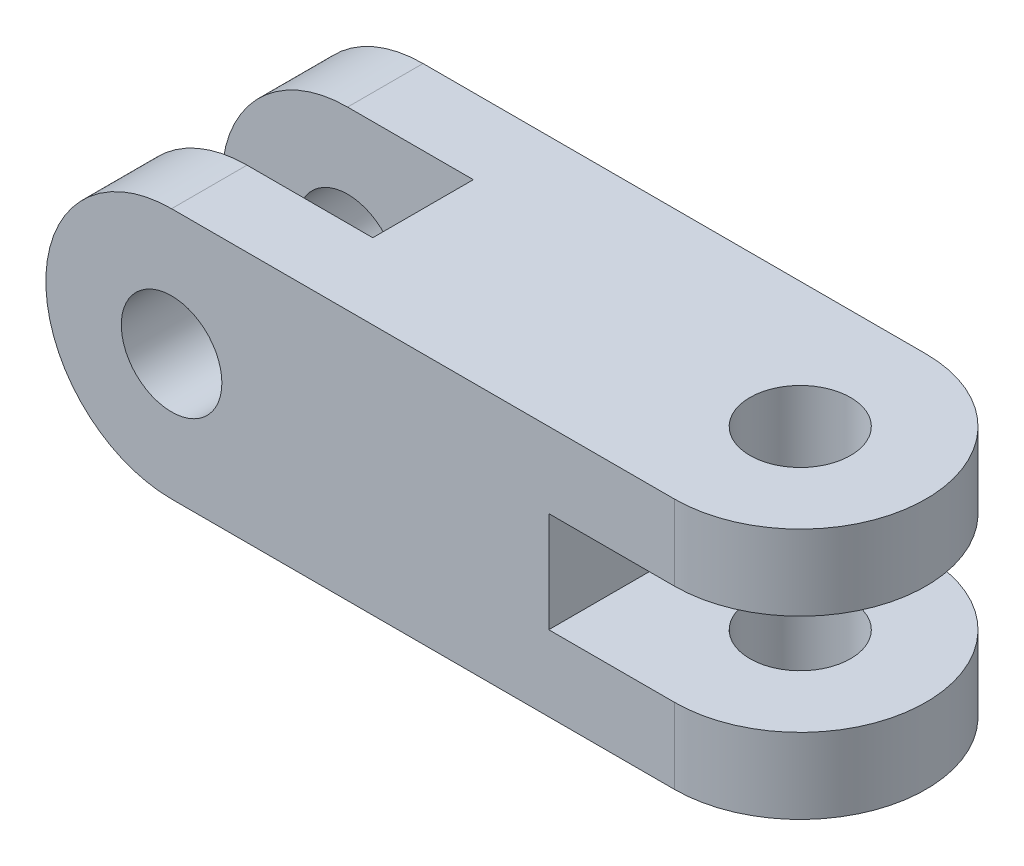
from build123d import *

# Parameters (mm, degrees)
SKETCH1_R           = 10
BOSS_EXTRUDE1_DEPTH = 50
CUT_EXTRUDE6_DEPTH  = 86
CUT_EXTRUDE7_DEPTH  = 86
SKETCH4_R           = 10
CUT_EXTRUDE8_DEPTH  = 86
SKETCH5_W           = 50
SKETCH5_H           = 20
CUT_EXTRUDE9_DEPTH  = 86


with BuildPart() as part:
    # Sketch1 → Boss-Extrude1 (new body)
    with BuildSketch(Plane.XY):
        with BuildLine():
            Line((12.5, 10), (62.5, 10))
            Line((62.5, 10), (62.5, 25))
            Line((62.5, 25), (-62.5, 25))
            ThreePointArc((-62.5, 25), (-87.5, 0), (-62.5, -25))
            Line((-62.5, -25), (62.5, -25))
            Line((62.5, -25), (62.5, -10))
            Line((62.5, -10), (12.5, -10))
            Line((12.5, -10), (12.5, 10))
        make_face()
        with Locations((-62.5, 0)):
            Circle(SKETCH1_R, mode=Mode.SUBTRACT)
    extrude(amount=-BOSS_EXTRUDE1_DEPTH)

    # Sketch2 → Cut-Extrude6 (cut)
    with BuildSketch(Plane(origin=(0, 25, 0), x_dir=(1, 0, 0), z_dir=(0, 1, 0))):
        with BuildLine():
            Line((37.5, 50), (62.5, 50))
            Line((62.5, 50), (62.5, 25))
            ThreePointArc((62.5, 25), (55.17766953, 42.67766953), (37.5, 50))
        make_face()
    extrude(amount=-CUT_EXTRUDE6_DEPTH, mode=Mode.SUBTRACT)

    # Sketch3 → Cut-Extrude7 (cut)
    with BuildSketch(Plane(origin=(0, 25, 0), x_dir=(1, 0, 0), z_dir=(0, 1, 0))):
        with BuildLine():
            Line((37.5, 0), (62.5, 0))
            Line((62.5, 0), (62.5, 25))
            ThreePointArc((62.5, 25), (55.17766953, 7.32233047), (37.5, 0))
        make_face()
    extrude(amount=-CUT_EXTRUDE7_DEPTH, mode=Mode.SUBTRACT)

    # Sketch4 → Cut-Extrude8 (cut)
    with BuildSketch(Plane(origin=(0, 25, 0), x_dir=(1, 0, 0), z_dir=(0, 1, 0))):
        with Locations(Location((37.5, 25, 0), (0, 0, 270))):
            Circle(SKETCH4_R)
    extrude(amount=-CUT_EXTRUDE8_DEPTH, mode=Mode.SUBTRACT)

    # Sketch5 → Cut-Extrude9 (cut)
    with BuildSketch(Plane(origin=(0, 25, 0), x_dir=(1, 0, 0), z_dir=(0, 1, 0))):
        with Locations((-62.5, 25)):
            Rectangle(SKETCH5_W, SKETCH5_H)
    extrude(amount=-CUT_EXTRUDE9_DEPTH, mode=Mode.SUBTRACT)


solid = part.part
